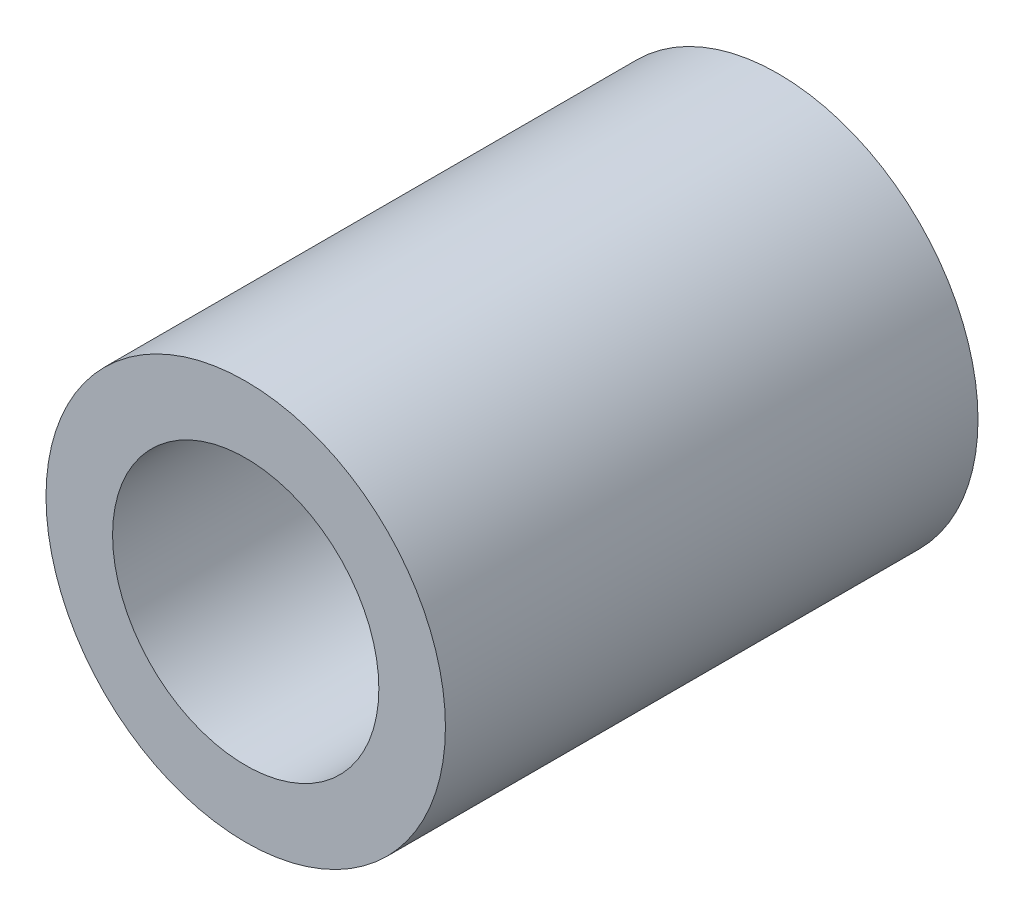
from build123d import *

# Parameters (mm, degrees)
SKETCH_1_R      = 3
SKETCH_1_R_2    = 2
EXTRUDE_1_DEPTH = 8


with BuildPart() as part:
    # Эскиз1 → Бобышка-Вытянуть1 (new body)
    with BuildSketch(Plane.XY.offset(1)):
        with Locations((135, 20)):
            Circle(SKETCH_1_R)
        with Locations((135, 20)):
            Circle(SKETCH_1_R_2, mode=Mode.SUBTRACT)
    extrude(amount=-EXTRUDE_1_DEPTH)


solid = part.part
